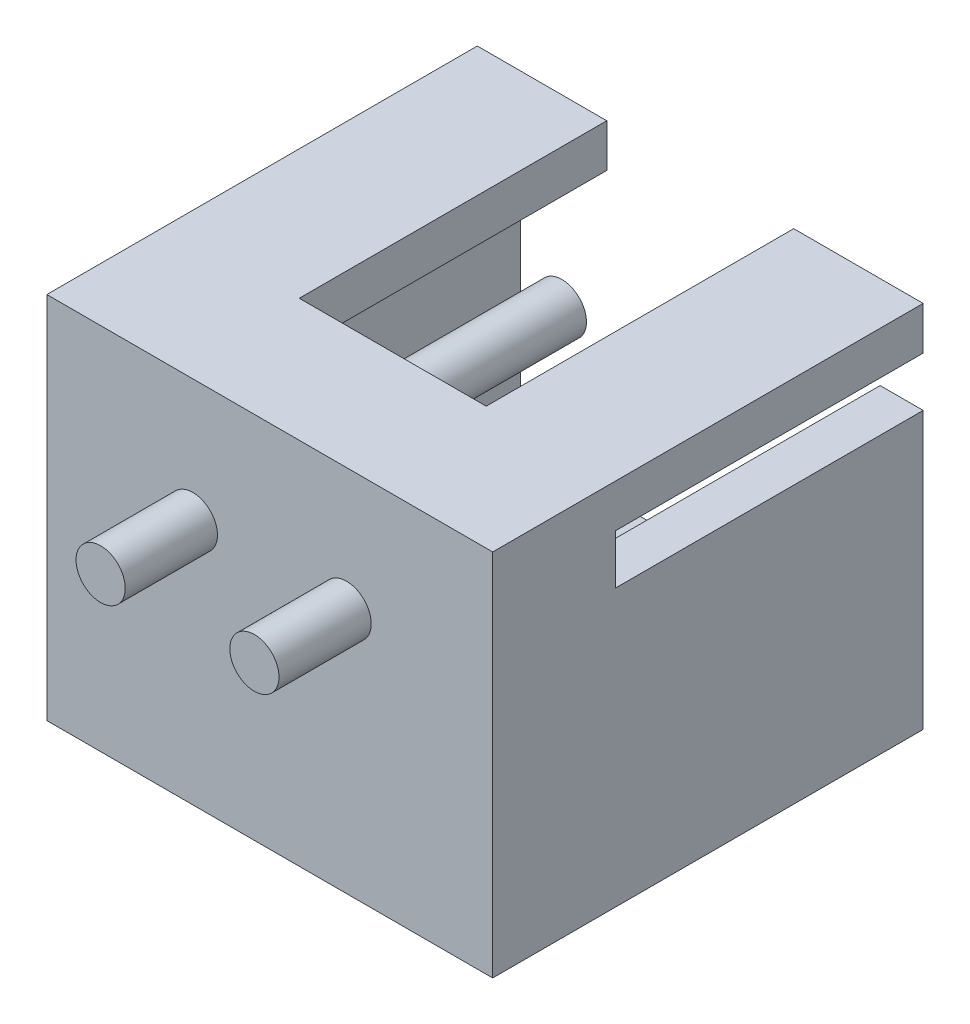
from build123d import *

# Parameters (mm, degrees)
SKETCH_1_W           = 7.25
SKETCH_1_H           = 6
EXTRUDE_1_DEPTH      = 7
SKETCH_2_W           = 5.85
SKETCH_2_H           = 4.6
CUT_EXTRUDE_1_DEPTH  = 5
SKETCH_3_W           = 0.7
SKETCH_3_H           = 0.8068671
SKETCH_3_W_2         = 3.039789906
SKETCH_3_H_2         = 0.7
CUT_EXTRUDE_2_DEPTH  = 5
EXTRUDE_2_DEPTH      = 4
EXTRUDE_2_DEPTH_BACK = 3.5
SKETCH_4_R           = 0.4


with BuildPart() as part:
    # 草图1 → 凸台-拉伸1 (new body)
    with BuildSketch(Plane.XY):
        with Locations((3.625, 3)):
            Rectangle(SKETCH_1_W, SKETCH_1_H)
    extrude(amount=EXTRUDE_1_DEPTH)

    # 草图2 → 切除-拉伸1 (cut)
    with BuildSketch(Plane.XY):
        with Locations((3.625, 3)):
            Rectangle(SKETCH_2_W, SKETCH_2_H)
    extrude(amount=CUT_EXTRUDE_1_DEPTH, mode=Mode.SUBTRACT)

    # 草图3 → 切除-拉伸2 (cut)
    with BuildSketch(Plane(origin=(0, 0, 0), x_dir=(-1, 0, 0), z_dir=(0, 0, -1))):
        with Locations((-6.9, 4.89656645)):
            Rectangle(SKETCH_3_W, SKETCH_3_H)
        with Locations((-0.35, 4.89656645)):
            Rectangle(SKETCH_3_W, SKETCH_3_H)
        with Locations((-3.625, 5.65)):
            Rectangle(SKETCH_3_W_2, SKETCH_3_H_2)
    extrude(amount=-CUT_EXTRUDE_2_DEPTH, mode=Mode.SUBTRACT)

    # 草图4 → 凸台-拉伸2 (add, two sides: drawn at the far end of the back side and taken through both)
    with BuildSketch(Plane(origin=(0, 0, 5), x_dir=(-1, 0, 0), z_dir=(0, 0, -1)).offset(-EXTRUDE_2_DEPTH_BACK)):
        with Locations((-4.875, 4)):
            Circle(SKETCH_4_R)
        with Locations((-2.375, 4)):
            Circle(SKETCH_4_R)
    extrude(amount=EXTRUDE_2_DEPTH + EXTRUDE_2_DEPTH_BACK)


solid = part.part
